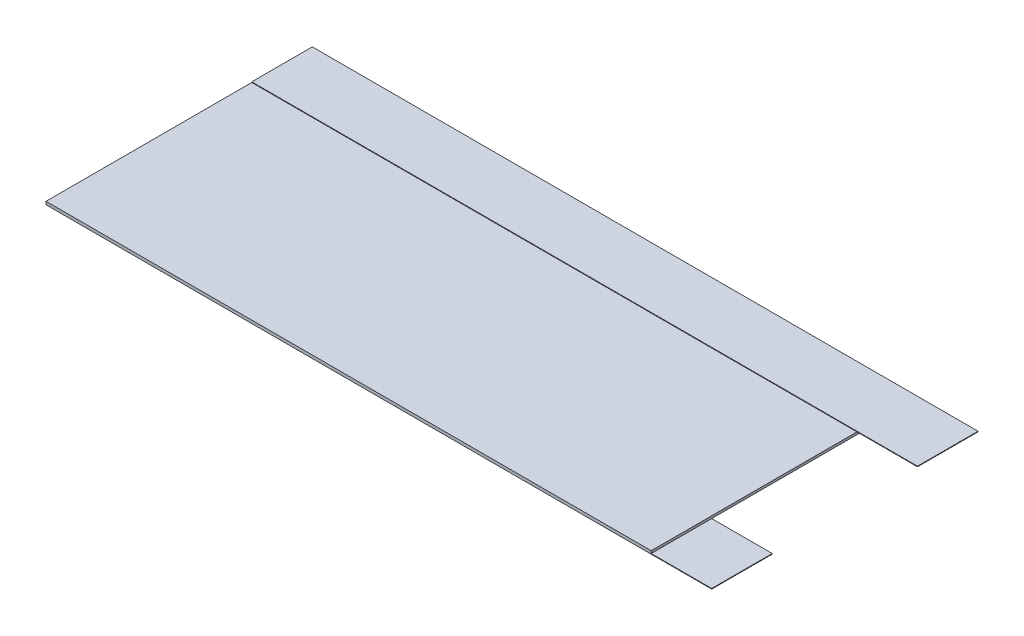
from build123d import *

# Parameters (mm, degrees)
SKETCH1_W           = 50
SKETCH1_H           = 22
BOSS_EXTRUDE1_DEPTH = 0.1
SKETCH2_W           = 55
SKETCH2_H           = 5
BOSS_EXTRUDE2_DEPTH = 0.05
CIRPATTERN1_COUNT   = 2


with BuildPart() as part:
    # Sketch1 → Boss-Extrude1 (new body)
    with BuildSketch(Plane(origin=(0, 0, 0), x_dir=(1, 0, 0), z_dir=(0, 1, 0))):
        Rectangle(SKETCH1_W, SKETCH1_H)
    extrude(amount=BOSS_EXTRUDE1_DEPTH)

    # Sketch2 → Boss-Extrude2 (add)
    with BuildSketch(Plane(origin=(0, 0.1, 0), x_dir=(1, 0, 0), z_dir=(0, 1, 0))):
        with Locations((2.5, 8.5)):
            Rectangle(SKETCH2_W, SKETCH2_H)
    extrude(amount=BOSS_EXTRUDE2_DEPTH)


with BuildPart() as cirpattern1_1:
    # CirPattern1: pattern copy
    add(part.part.rotate(Axis((-27.75005375, 0, 0), (1, 0, 0)), 1 * 360 / CIRPATTERN1_COUNT))

    # Combine2: union part
    add(part.part)


solid = cirpattern1_1.part
